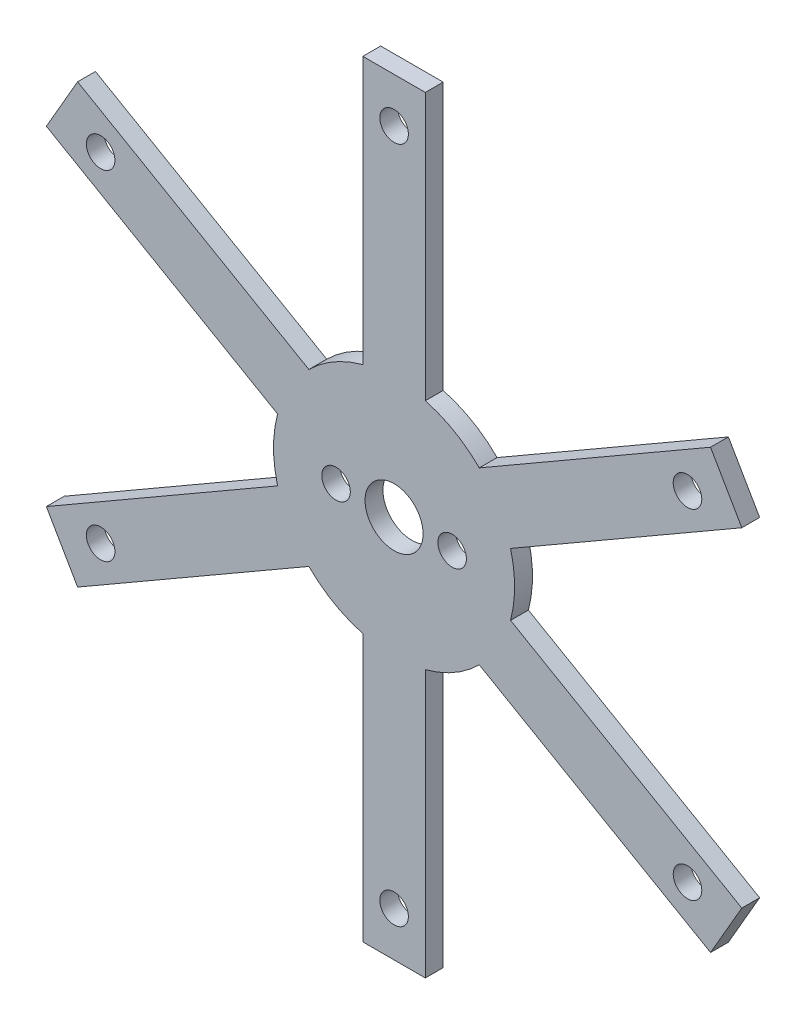
from build123d import *

# Parameters (mm, degrees)
SKETCH_1_R               = 13.5
SKETCH_1_R_2             = 3.25
SKETCH_1_R_3             = 1.6
EXTRUDE_3_DEPTH          = 2
EXTRUDE_4_DEPTH          = 2
PATTERN_CIRCULAR_1_COUNT = 6
CUT_EXTRUDE_1_REACH      = 60
SKETCH_2_R               = 1.6
PATTERN_CIRCULAR_2_COUNT = 6


with BuildPart() as part:
    # ｽｹｯﾁ1 → ﾎﾞｽ - 押し出し3 (new body)
    with BuildSketch(Plane.XY):
        Circle(SKETCH_1_R)
        Circle(SKETCH_1_R_2, mode=Mode.SUBTRACT)
        with Locations((6.5, 0)):
            Circle(SKETCH_1_R_3, mode=Mode.SUBTRACT)
        with Locations((-6.5, 0)):
            Circle(SKETCH_1_R_3, mode=Mode.SUBTRACT)
    extrude(amount=EXTRUDE_3_DEPTH)

    # ｽｹｯﾁ1<7> → ﾎﾞｽ - 押し出し4 (add)
    with BuildSketch(Plane.XY):
        with BuildLine():
            ThreePointArc((9.541589791, 9.550291318), (11.691342951, 6.75), (13.041589791, 3.488113492))
            Line((13.041589791, 3.488113492), (38.937130839, 18.438911087))
            Line((38.937130839, 18.438911087), (35.437130839, 24.501088913))
            Line((35.437130839, 24.501088913), (9.541589791, 9.550291318))
        make_face()
    extrude_4 = extrude(amount=EXTRUDE_4_DEPTH)

    # 円形ﾊﾟﾀｰﾝ1: ﾎﾞｽ - 押し出し4 ×6 about axis
    pattern_circular_1_axis = Axis((0, 0, 2), (0, 0, 1))
    for i in range(1, PATTERN_CIRCULAR_1_COUNT):
        add(extrude_4.rotate(pattern_circular_1_axis, i * 360 / PATTERN_CIRCULAR_1_COUNT))

    # ｽｹｯﾁ2 → ｶｯﾄ - 押し出し1 (cut, up to next)
    with BuildSketch(Plane.XY.offset(2), mode=Mode.PRIVATE) as cut_extrude_1_sk1:
        with Locations((32.85700382, 18.97)):
            Circle(SKETCH_2_R)
    cut_extrude_1_tool1 = extrude(cut_extrude_1_sk1.sketch, amount=-CUT_EXTRUDE_1_REACH, mode=Mode.PRIVATE) & part.part
    cut_extrude_1 = cut_extrude_1_tool1.solids().sort_by_distance((32.857004, 18.97, 2))[0]
    add(cut_extrude_1, mode=Mode.SUBTRACT)

    # 円形ﾊﾟﾀｰﾝ2: ｶｯﾄ - 押し出し1 ×6 about axis
    pattern_circular_2_axis = Axis((0, 0, 2), (0, 0, 1))
    for i in range(1, PATTERN_CIRCULAR_2_COUNT):
        add(cut_extrude_1.rotate(pattern_circular_2_axis, i * 360 / PATTERN_CIRCULAR_2_COUNT), mode=Mode.SUBTRACT)


solid = part.part
